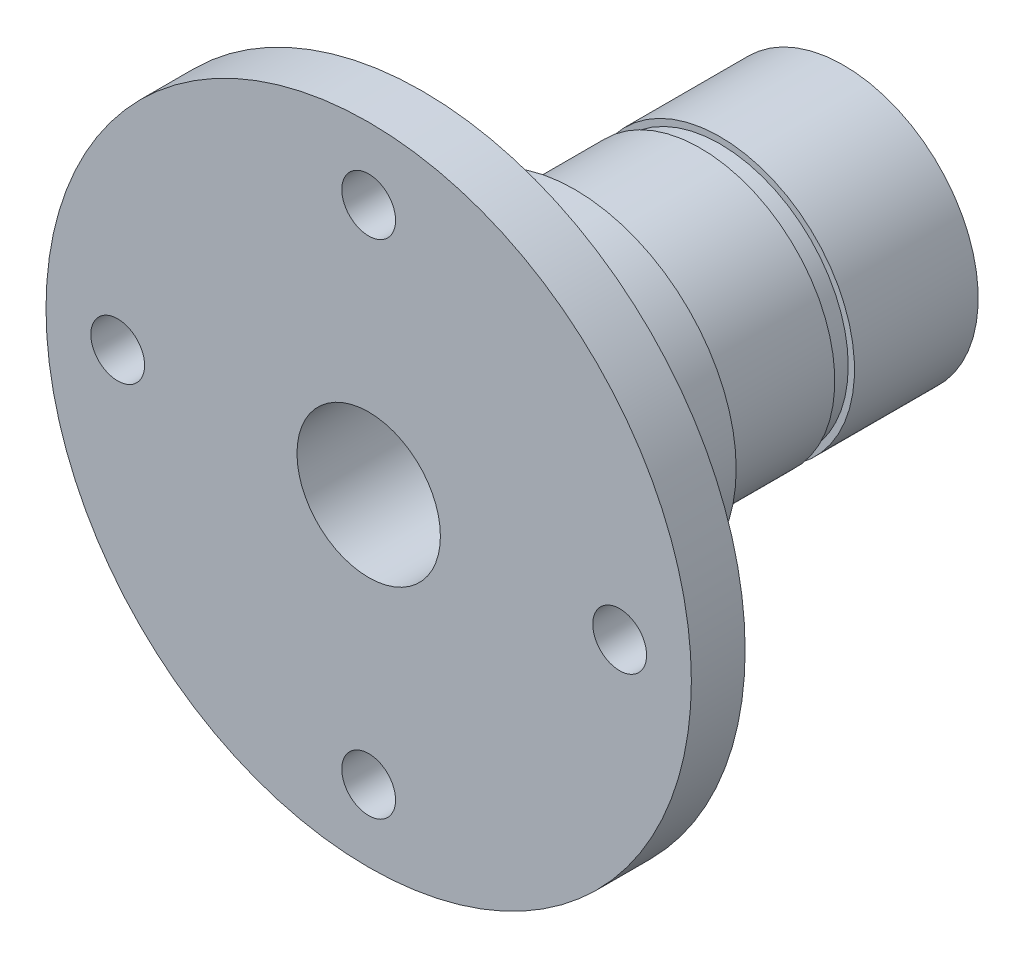
from build123d import *
from build123d.topology import SkipClean

# Parameters (mm, degrees)
SKETCH_1_R               = 18
SKETCH_1_R_2             = 1.5
SKETCH_1_R_3             = 4
EXTRUDE_1_DEPTH          = 3
EXTRUDE_START            = 8.5
SKETCH_2_R               = 9
SKETCH_2_R_2             = 4
EXTRUDE_2_DEPTH          = 8.5
EXTRUDE_START_2          = 15
SKETCH_3_R               = 7.5
SKETCH_3_R_2             = 4
EXTRUDE_3_DEPTH          = 15
CUT_EXTRUDE_START        = 1.1
SKETCH_4_R               = 7.5
SKETCH_4_R_2             = 7.15
CUT_EXTRUDE_2_DEPTH      = 1.1
CUT_EXTRUDE_3_REACH      = 36.645
CUT_EXTRUDE_3_END_RADIUS = 7.5
SKETCH_5_R               = 1.5
CUT_EXTRUDE_4_REACH      = 36.645
CUT_EXTRUDE_4_END_RADIUS = 7.5
SKETCH_7_R               = 1.5


with BuildPart() as part:
    # 草图1 → 凸台-拉伸1 (new body)
    with BuildSketch(Plane.XY):
        Circle(SKETCH_1_R)
        with Locations((0, 14)):
            Circle(SKETCH_1_R_2, mode=Mode.SUBTRACT)
        with Locations((14, 0)):
            Circle(SKETCH_1_R_2, mode=Mode.SUBTRACT)
        with Locations((0, -14)):
            Circle(SKETCH_1_R_2, mode=Mode.SUBTRACT)
        with Locations((-14, 0)):
            Circle(SKETCH_1_R_2, mode=Mode.SUBTRACT)
        Circle(SKETCH_1_R_3, mode=Mode.SUBTRACT)
    extrude(amount=EXTRUDE_1_DEPTH)

    # 草图2 → 凸台-拉伸2 (add)
    with SkipClean():  # the faces are left unmerged after this step: merging them gives an invalid solid
        with BuildSketch(Plane(origin=(0, 0, 0), x_dir=(-1, 0, 0), z_dir=(0, 0, -1)).offset(EXTRUDE_START)):
            with Locations(Location((0, 0, 0), (0, 0, 180))):
                Circle(SKETCH_2_R)
            Circle(SKETCH_2_R_2, mode=Mode.SUBTRACT)
        extrude(amount=-EXTRUDE_2_DEPTH)

    # 草图3 → 凸台-拉伸3 (add)
    with SkipClean():  # the faces are left unmerged after this step: merging them gives an invalid solid
        with BuildSketch(Plane(origin=(0, 0, -8.5), x_dir=(-1, 0, 0), z_dir=(0, 0, -1)).offset(EXTRUDE_START_2)):
            Circle(SKETCH_3_R)
            Circle(SKETCH_3_R_2, mode=Mode.SUBTRACT)
        extrude(amount=-EXTRUDE_3_DEPTH)

    # 草图4 → 切除-拉伸2 (cut)
    with SkipClean():  # the faces are left unmerged after this step: merging them gives an invalid solid
        with BuildSketch(Plane(origin=(0, 0, -15.5), x_dir=(-1, 0, 0), z_dir=(0, 0, -1)).offset(CUT_EXTRUDE_START)):
            Circle(SKETCH_4_R)
            Circle(SKETCH_4_R_2, mode=Mode.SUBTRACT)
        extrude(amount=-CUT_EXTRUDE_2_DEPTH, mode=Mode.SUBTRACT)

    # 切除-拉伸3: up to this cylinder (the profile starts inside it)
    with SkipClean():  # the faces are left unmerged after this step: merging them gives an invalid solid
        cut_extrude_3_end = Plane(origin=(0, 0, -20.6), z_dir=(0, 0, 1)) * Cylinder(CUT_EXTRUDE_3_END_RADIUS, 89.29, mode=Mode.PRIVATE)
        # 草图5 → 切除-拉伸3 (cut, up to the surface)
        with BuildSketch(Plane(origin=(0, 0, 0), x_dir=(1, 0, 0), z_dir=(0, 1, 0)), mode=Mode.PRIVATE) as cut_extrude_3_sk1:
            with Locations(Location((0, 20.6, 0), (0, 0, 270))):
                Circle(SKETCH_5_R)
        cut_extrude_3_tool1 = extrude(cut_extrude_3_sk1.sketch, amount=-CUT_EXTRUDE_3_REACH, mode=Mode.PRIVATE) & cut_extrude_3_end
        add(cut_extrude_3_tool1.solids().sort_by_distance((0, 0, -20.6))[0], mode=Mode.SUBTRACT)

    # 切除-拉伸4: up to this cylinder (the profile starts inside it)
    with SkipClean():  # the faces are left unmerged after this step: merging them gives an invalid solid
        cut_extrude_4_end = Plane(origin=(0, 0, -20.6), z_dir=(0, 0, 1)) * Cylinder(CUT_EXTRUDE_4_END_RADIUS, 89.29, mode=Mode.PRIVATE)
        # 草图7 → 切除-拉伸4 (cut, up to the surface)
        with BuildSketch(Plane(origin=(0, 0, 0), x_dir=(0, 0, -1), z_dir=(1, 0, 0)), mode=Mode.PRIVATE) as cut_extrude_4_sk1:
            with Locations((20.6, 0)):
                Circle(SKETCH_7_R)
        cut_extrude_4_tool1 = extrude(cut_extrude_4_sk1.sketch, amount=-CUT_EXTRUDE_4_REACH, mode=Mode.PRIVATE) & cut_extrude_4_end
        add(cut_extrude_4_tool1.solids().sort_by_distance((0, 0, -20.6))[0], mode=Mode.SUBTRACT)


solid = part.part
